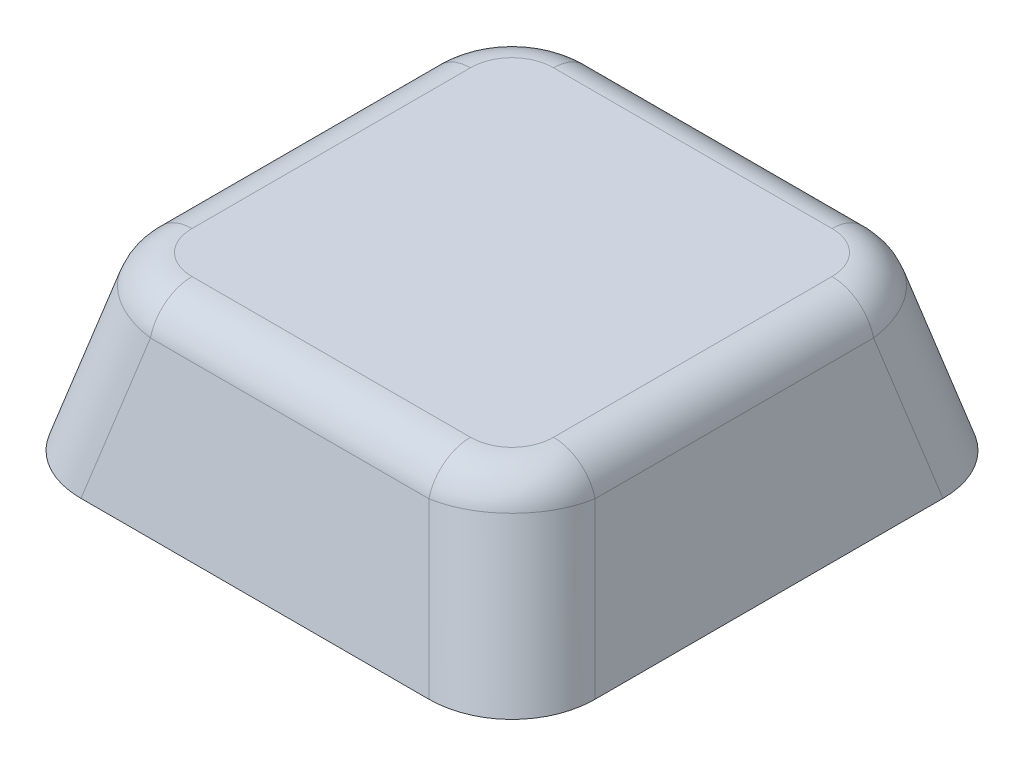
from build123d import *

# Parameters (mm, degrees)
FILLET_1_R = 1
FILLET_2_R = 1
FILLET_3_R = 1
FILLET_4_R = 1
FILLET_5_R = 0.5


with BuildPart() as part:
    # 草图1 → 放样1 section 0
    with BuildSketch(Plane(origin=(0, 0, 0), x_dir=(1, 0, 0), z_dir=(0, 1, 0))):
        with BuildLine():
            Line((-3, 3), (3, 3))
            Line((3, 3), (3, -3))
            Line((3, -3), (-3, -3))
            Line((-3, -3), (-3, 3))
        make_face()
    # 草图2 → 放样1 section 1
    with BuildSketch(Plane(origin=(0, 2, 0), x_dir=(1, 0, 0), z_dir=(0, 1, 0))):
        with BuildLine():
            Line((-2.5, 2.5), (2.5, 2.5))
            Line((2.5, 2.5), (2.5, -2.5))
            Line((2.5, -2.5), (-2.5, -2.5))
            Line((-2.5, -2.5), (-2.5, 2.5))
        make_face()
    loft()

    # 圆角1
    fillet_1_edges = [part.edges().sort_by_distance(p)[0] for p in [
        (2.75, 1, 2.75),
    ]]
    fillet(fillet_1_edges, radius=FILLET_1_R)

    # 圆角2
    fillet_2_edges = [part.edges().sort_by_distance(p)[0] for p in [
        (-2.75, 1, 2.75),
    ]]
    fillet(fillet_2_edges, radius=FILLET_2_R)

    # 圆角3
    fillet_3_edges = [part.edges().sort_by_distance(p)[0] for p in [
        (-2.75, 1, -2.75),
    ]]
    fillet(fillet_3_edges, radius=FILLET_3_R)

    # 圆角4
    fillet_4_edges = [part.edges().sort_by_distance(p)[0] for p in [
        (2.75, 1, -2.75),
    ]]
    fillet(fillet_4_edges, radius=FILLET_4_R)

    # 圆角5
    fillet_5_edges = [part.edges().sort_by_distance(p)[0] for p in [
        (2.219223594, 2, -2.219223593),
        (2.5, 2, 0),
        (2.219223593, 2, 2.219223594),
        (0, 2, 2.5),
        (-2.219223594, 2, 2.219223593),
        (-2.5, 2, 0),
        (-2.219223593, 2, -2.219223594),
        (0, 2, -2.5),
    ]]
    fillet(fillet_5_edges, radius=FILLET_5_R)


solid = part.part
